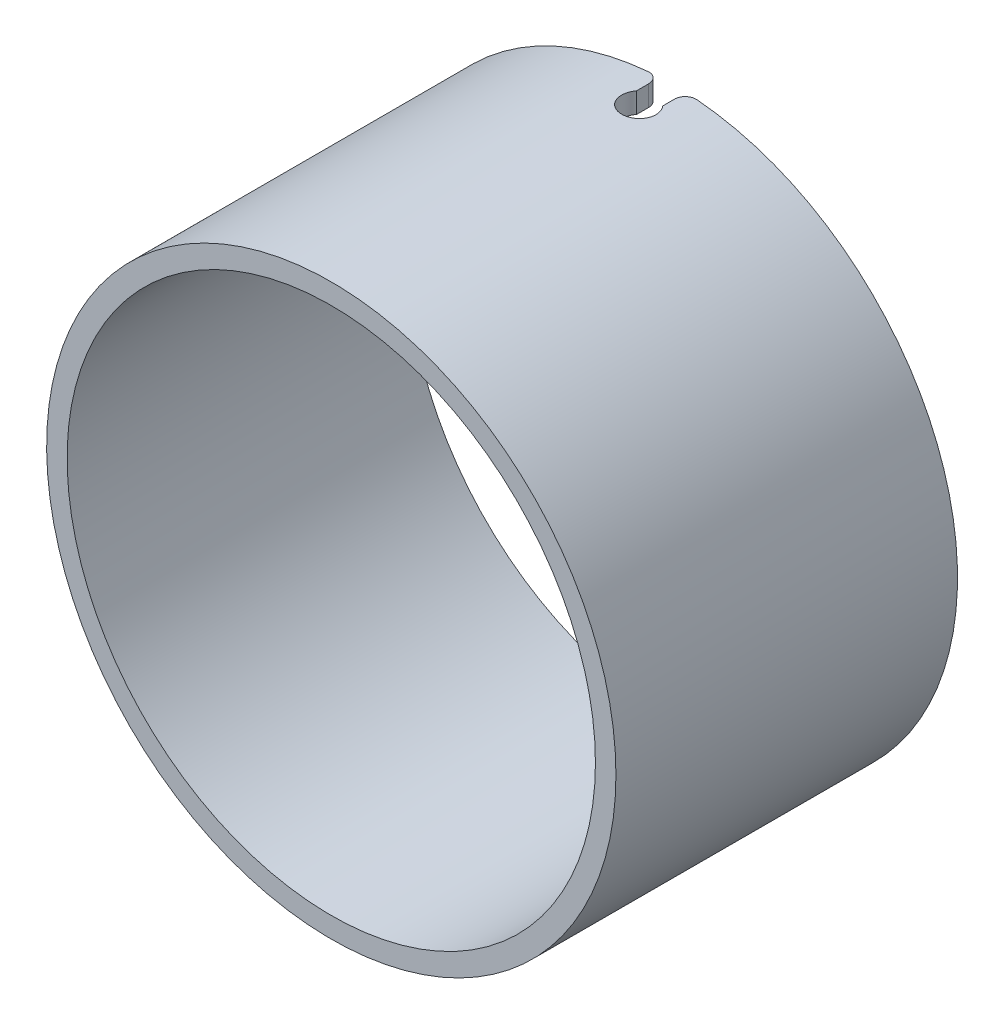
from build123d import *

# Parameters (mm, degrees)
SKETCH_1_R               = 25
SKETCH_1_R_2             = 23.2
EXTRUDE_1_DEPTH          = 30
CUT_EXTRUDE_1_DEPTH      = 47.368092477
CUT_EXTRUDE_1_DEPTH_BACK = 47.368092477
FILLET_1_R               = 1


with BuildPart() as part:
    # 草图1 → 凸台-拉伸1 (new body)
    with BuildSketch(Plane.XY):
        Circle(SKETCH_1_R)
        Circle(SKETCH_1_R_2, mode=Mode.SUBTRACT)
    extrude(amount=EXTRUDE_1_DEPTH)

    # 草图3 → 切除-拉伸1 (cut, two sides: drawn at the far end of the back side and taken through both)
    with BuildSketch(Plane(origin=(0, 0, 0), x_dir=(1, 0, 0), z_dir=(0, 1, 0)).offset(-CUT_EXTRUDE_1_DEPTH_BACK)):
        with BuildLine():
            Line((-1.15, 0), (-1.15, -2.036931986))
            ThreePointArc((-1.15, -2.036931986), (0, -1.5), (1.15, -2.036931986))
            Line((1.15, -2.036931986), (1.15, 0))
            Line((1.15, 0), (-1.15, 0))
        make_face()
        with BuildLine():
            Line((-1.15, -2.036931986), (-1.15, -3.963068014))
            ThreePointArc((-1.15, -3.963068014), (0, -4.5), (1.15, -3.963068014))
            Line((1.15, -3.963068014), (1.15, -2.036931986))
            ThreePointArc((1.15, -2.036931986), (0, -1.5), (-1.15, -2.036931986))
        make_face()
        with BuildLine():
            Line((1.15, -2.036931986), (1.15, -3.963068014))
            ThreePointArc((1.15, -3.963068014), (1.409787218, -3.512347538), (1.5, -3))
            ThreePointArc((1.5, -3), (1.409787218, -2.487652462), (1.15, -2.036931986))
        make_face()
        with BuildLine():
            ThreePointArc((-1.15, -2.036931986), (-1.5, -3), (-1.15, -3.963068014))
            Line((-1.15, -3.963068014), (-1.15, -2.036931986))
        make_face()
    extrude(amount=CUT_EXTRUDE_1_DEPTH + CUT_EXTRUDE_1_DEPTH_BACK, mode=Mode.SUBTRACT)

    # 圆角1
    fillet_1_edges = [part.edges().sort_by_distance(p)[0] for p in [
        (-1.15, 24.072508154, 0),
        (-1.15, -24.072508154, 0),
        (1.15, -24.072508154, 0),
        (1.15, 24.072508154, 0),
    ]]
    fillet(fillet_1_edges, radius=FILLET_1_R)


solid = part.part
